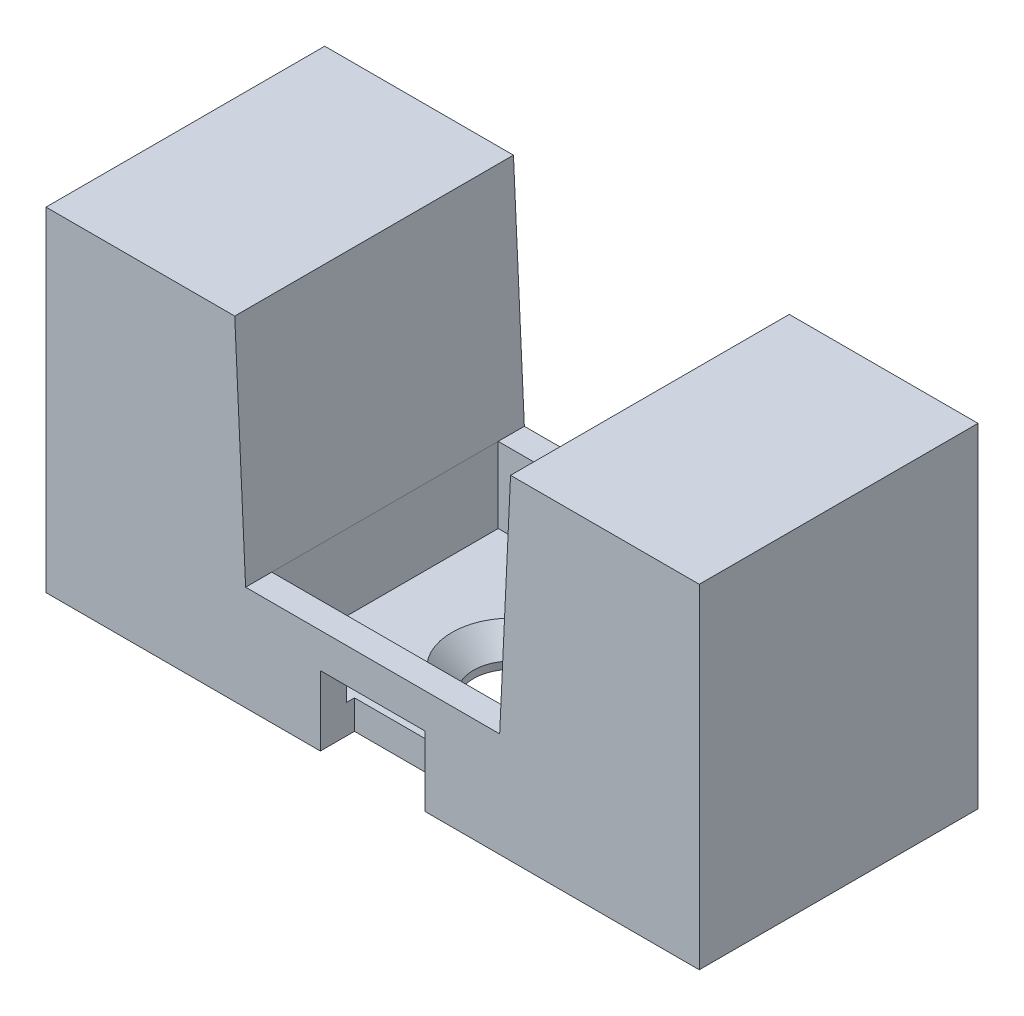
from build123d import *

# Parameters (mm, degrees)
SKETCH1_W           = 22.5
SKETCH1_H           = 9.6
BOSS_EXTRUDE1_DEPTH = 11.5
CUT_EXTRUDE1_DEPTH  = 19.73426006
SKETCH4_W           = 8.75
SKETCH4_H           = 7.8
CUT_EXTRUDE2_DEPTH  = 2.6
SKETCH5_R           = 1.325
CUT_EXTRUDE3_DEPTH  = 17.119941067
CHAMFER1_SIZE       = 0.75
SKETCH6_W           = 3.6
SKETCH6_H           = 1.175
CUT_EXTRUDE4_DEPTH  = 2.4


with BuildPart() as part:
    # Sketch1 → Boss-Extrude1 (new body)
    with BuildSketch(Plane(origin=(0, 0, 0), x_dir=(1, 0, 0), z_dir=(0, 1, 0))):
        Rectangle(SKETCH1_W, SKETCH1_H)
    extrude(amount=BOSS_EXTRUDE1_DEPTH)

    # Sketch3 → Cut-Extrude1 (cut, through all)
    with BuildSketch(Plane.XY.offset(4.8)):
        Polygon((4.75, 11.5), (4.375, 3.6), (-4.375, 3.6), (-4.75, 11.5), align=None)
    extrude(amount=-CUT_EXTRUDE1_DEPTH, mode=Mode.SUBTRACT)

    # Sketch4 → Cut-Extrude2 (cut)
    with BuildSketch(Plane(origin=(0, 3.6, 0), x_dir=(1, 0, 0), z_dir=(0, 1, 0))):
        Rectangle(SKETCH4_W, SKETCH4_H)
    extrude(amount=-CUT_EXTRUDE2_DEPTH, mode=Mode.SUBTRACT)

    # Sketch5 → Cut-Extrude3 (cut, through all)
    with BuildSketch(Plane(origin=(0, 1, 0), x_dir=(1, 0, 0), z_dir=(0, 1, 0))):
        with Locations(Location((0, 0, 0), (0, 0, 270))):
            Circle(SKETCH5_R)
    extrude(amount=-CUT_EXTRUDE3_DEPTH, mode=Mode.SUBTRACT)

    # Chamfer1
    chamfer1_edges = [part.edges().sort_by_distance(p)[0] for p in [
        (0, 1, -1.325),
    ]]
    chamfer(chamfer1_edges, length=CHAMFER1_SIZE)

    # Sketch6 → Cut-Extrude4 (cut)
    with BuildSketch(Plane.XZ):
        with Locations((0, 4.2125)):
            Rectangle(SKETCH6_W, SKETCH6_H)
    cut_extrude4 = extrude(amount=-CUT_EXTRUDE4_DEPTH, mode=Mode.SUBTRACT)

    # Mirror1: Cut-Extrude4 across plane
    add(cut_extrude4.mirror(Plane.XY), mode=Mode.SUBTRACT)


solid = part.part
